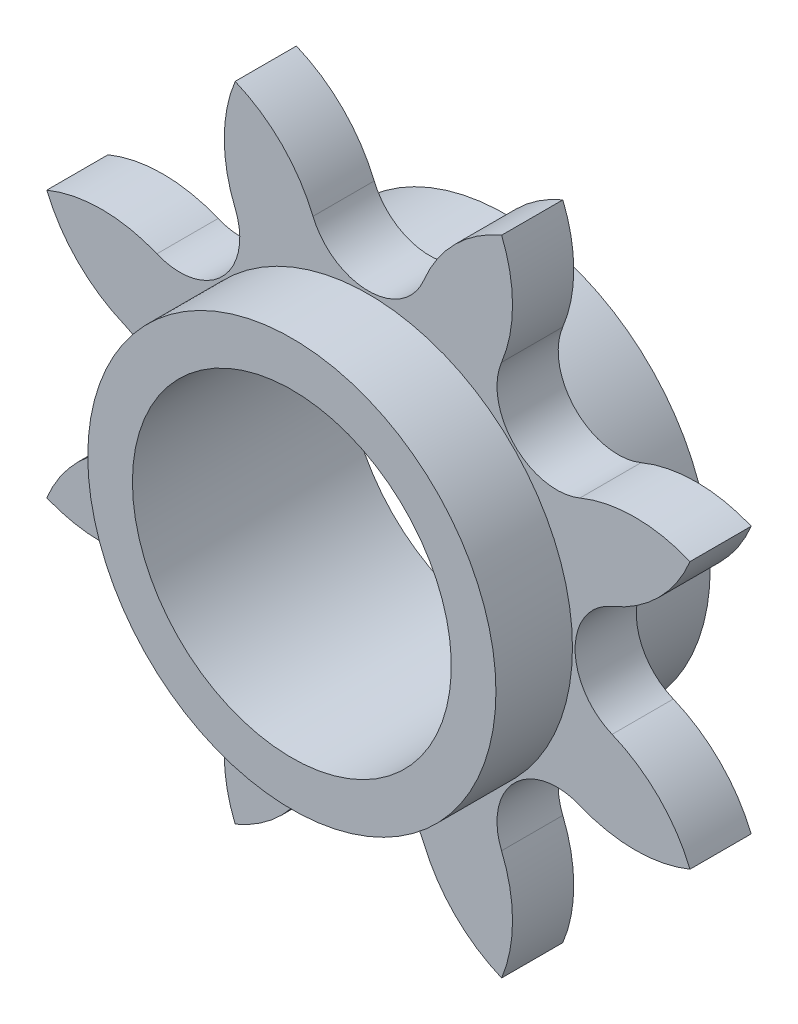
from build123d import *
from build123d.topology import SkipClean

# Parameters (mm, degrees)
MODEL_R             = 6.25
BOSS_EXTRUDE1_DEPTH = 2.4
BOSS_EXTRUDE2_START = 3
SKETCH2_R           = 8
SKETCH2_R_2         = 6.25
BOSS_EXTRUDE2_DEPTH = 3


with BuildPart() as part:
    # Model → Boss-Extrude1 (new body)
    with BuildSketch(Plane.XY):
        with BuildLine():
            ThreePointArc((5.219883463, 8.290306898), (5.649962695, 10.449038711), (5.222503822, 12.608290919))
            ThreePointArc((5.222503822, 12.608290919), (3.39344735, 11.383736442), (2.171116571, 9.55319316))
            ThreePointArc((2.171116571, 9.55319316), (7.05e-06, 8.10252753), (-2.171097098, 9.553201202))
            ThreePointArc((-2.171097098, 9.553201202), (-3.393450986, 11.383763689), (-5.222542517, 12.608317574))
            ThreePointArc((-5.222542517, 12.608317574), (-5.649987545, 10.449048181), (-5.219883434, 8.290306876))
            ThreePointArc((-5.219883434, 8.290306876), (-5.729313534, 5.729323511), (-8.290298786, 5.219902898))
            ThreePointArc((-8.290298786, 5.219902898), (-10.449036556, 5.649974072), (-12.608290861, 5.222503812))
            ThreePointArc((-12.608290861, 5.222503812), (-11.383736397, 3.393447352), (-9.553193136, 2.171116571))
            ThreePointArc((-9.553193136, 2.171116571), (-8.102527499, 7.032e-06), (-9.55320119, -2.171097126))
            ThreePointArc((-9.55320119, -2.171097126), (-11.38376367, -3.393451008), (-12.608317555, -5.222542529))
            ThreePointArc((-12.608317555, -5.222542529), (-10.449048162, -5.649987556), (-8.290306857, -5.219883446))
            ThreePointArc((-8.290306857, -5.219883446), (-5.729323474, -5.729313553), (-5.219902867, -8.290298826))
            ThreePointArc((-5.219902867, -8.290298826), (-5.649974041, -10.449036588), (-5.222503789, -12.608290885))
            ThreePointArc((-5.222503789, -12.608290885), (-3.393447328, -11.383736421), (-2.171116547, -9.55319316))
            ThreePointArc((-2.171116547, -9.55319316), (-7.008e-06, -8.102527522), (2.17109715, -9.553201214))
            ThreePointArc((2.17109715, -9.553201214), (3.393451032, -11.383763694), (5.222542552, -12.608317579))
            ThreePointArc((5.222542552, -12.608317579), (5.64998758, -10.449048185), (5.21988347, -8.290306881))
            ThreePointArc((5.21988347, -8.290306881), (5.729313577, -5.729323498), (8.29029885, -5.219902891))
            ThreePointArc((8.29029885, -5.219902891), (10.449036612, -5.649974065), (12.608290909, -5.222503812))
            ThreePointArc((12.608290909, -5.222503812), (11.383736445, -3.393447352), (9.553193184, -2.171116571))
            ThreePointArc((9.553193184, -2.171116571), (8.102527546, -7.031e-06), (9.553201238, 2.171097126))
            ThreePointArc((9.553201238, 2.171097126), (11.383763724, 3.393451015), (12.60831761, 5.222542545))
            ThreePointArc((12.60831761, 5.222542545), (10.449048209, 5.649987575), (8.290306898, 5.219883463))
            ThreePointArc((8.290306898, 5.219883463), (5.729299098, 5.729299098), (5.219883463, 8.290306898))
        make_face()
        Circle(MODEL_R, mode=Mode.SUBTRACT)
    extrude(amount=BOSS_EXTRUDE1_DEPTH)

    # Sketch2 → Boss-Extrude2 (add)
    with SkipClean():  # the faces are left unmerged after this step: merging them gives an invalid solid
        with BuildSketch(Plane(origin=(0, 0, 0), x_dir=(-1, 0, 0), z_dir=(0, 0, -1)).offset(BOSS_EXTRUDE2_START)):
            Circle(SKETCH2_R)
            Circle(SKETCH2_R_2, mode=Mode.SUBTRACT)
        boss_extrude2 = extrude(amount=-BOSS_EXTRUDE2_DEPTH)

    # Mirror1: Boss-Extrude2 across plane
    add(boss_extrude2.mirror(Plane(origin=(0, 0, 1.199999886), x_dir=(1, 0, 0), z_dir=(0, 0, -1))))


solid = part.part
